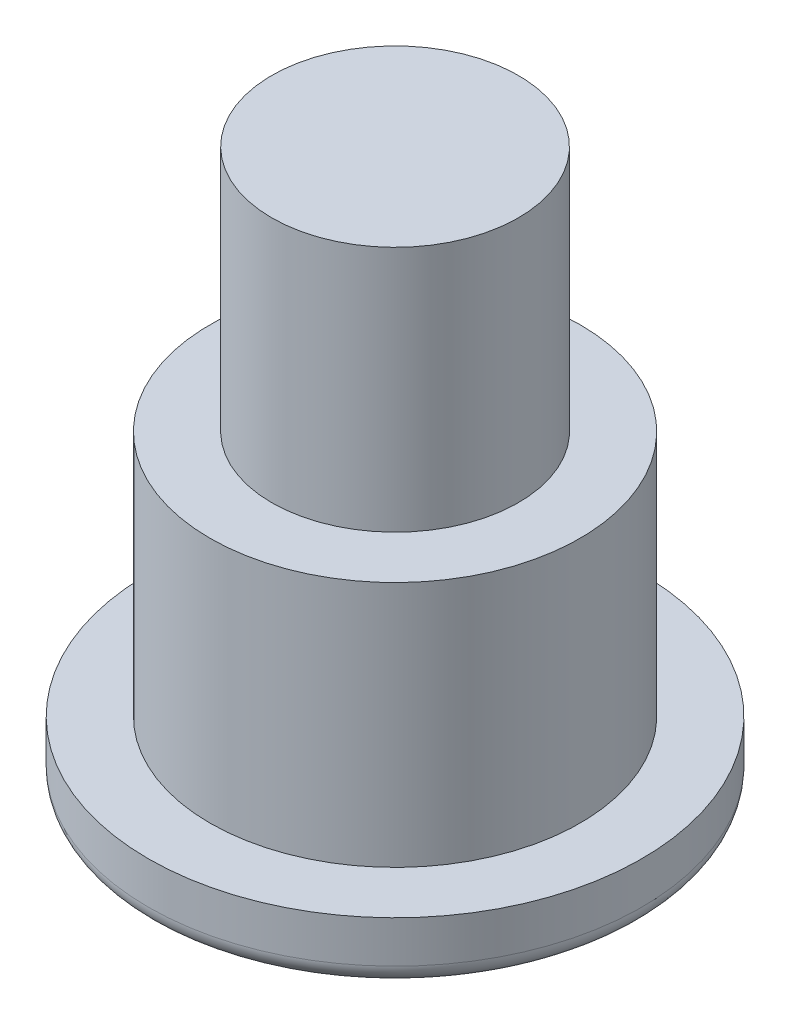
from build123d import *

# Parameters (mm, degrees)
SKETCH1_R           = 3.175
BOSS_EXTRUDE1_DEPTH = 0.79375
SKETCH2_R           = 2.38125
BOSS_EXTRUDE2_DEPTH = 3.175
SKETCH3_R           = 1.5875
BOSS_EXTRUDE3_DEPTH = 3.175
FILLET1_R           = 0.254


with BuildPart() as part:
    # Sketch1 → Boss-Extrude1 (new body)
    with BuildSketch(Plane(origin=(0, 0, 0), x_dir=(1, 0, 0), z_dir=(0, 1, 0))):
        Circle(SKETCH1_R)
    extrude(amount=BOSS_EXTRUDE1_DEPTH)

    # Sketch2 → Boss-Extrude2 (add)
    with BuildSketch(Plane(origin=(0, 0.79375, 0), x_dir=(1, 0, 0), z_dir=(0, 1, 0))):
        Circle(SKETCH2_R)
    extrude(amount=BOSS_EXTRUDE2_DEPTH)

    # Sketch3 → Boss-Extrude3 (add)
    with BuildSketch(Plane(origin=(0, 3.96875, 0), x_dir=(1, 0, 0), z_dir=(0, 1, 0))):
        Circle(SKETCH3_R)
    extrude(amount=BOSS_EXTRUDE3_DEPTH)

    # Fillet1
    fillet1_edges = [part.edges().sort_by_distance(p)[0] for p in [
        (-3.175, 0, 0),
    ]]
    fillet(fillet1_edges, radius=FILLET1_R)


solid = part.part
